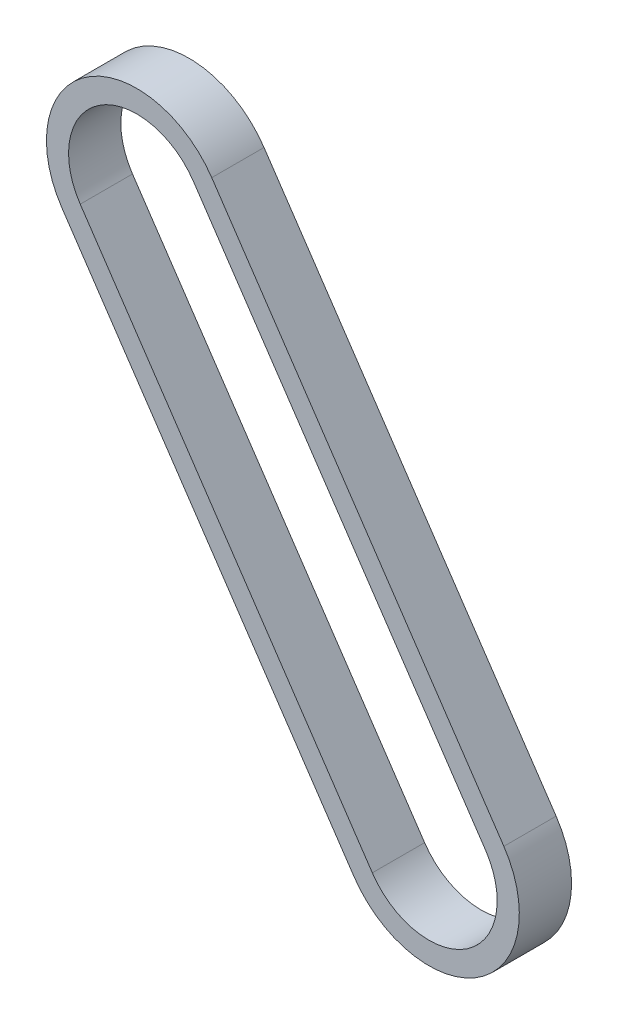
from build123d import *

# Parameters (mm, degrees)
EXTRUDE_THIN1_DEPTH = 4.500000017


with BuildPart() as part:
    # Sketch2 → Extrude-Thin1 (new, symmetric)
    with BuildSketch(Plane.XY):
        with BuildLine():
            Line((37.389462284, -83.263507734), (-12.902389333, -8.702771493))
            ThreePointArc((-12.902389333, -8.702771493), (-8.702771493, 12.902389333), (12.902389333, 8.702771493))
            Line((12.902389333, 8.702771493), (63.19424095, -65.857964749))
            ThreePointArc((63.19424095, -65.857964749), (58.99462311, -87.463125575), (37.389462284, -83.263507734))
        make_face()
        with BuildLine():
            Line((40.548095435, -81.132982772), (-9.743756182, -6.572246531))
            ThreePointArc((-9.743756182, -6.572246531), (-6.572246531, 9.743756182), (9.743756182, 6.572246531))
            Line((9.743756182, 6.572246531), (60.035607799, -67.988489711))
            ThreePointArc((60.035607799, -67.988489711), (56.864098147, -84.304492423), (40.548095435, -81.132982772))
        make_face(mode=Mode.SUBTRACT)
    extrude(amount=EXTRUDE_THIN1_DEPTH, both=True)


solid = part.part
